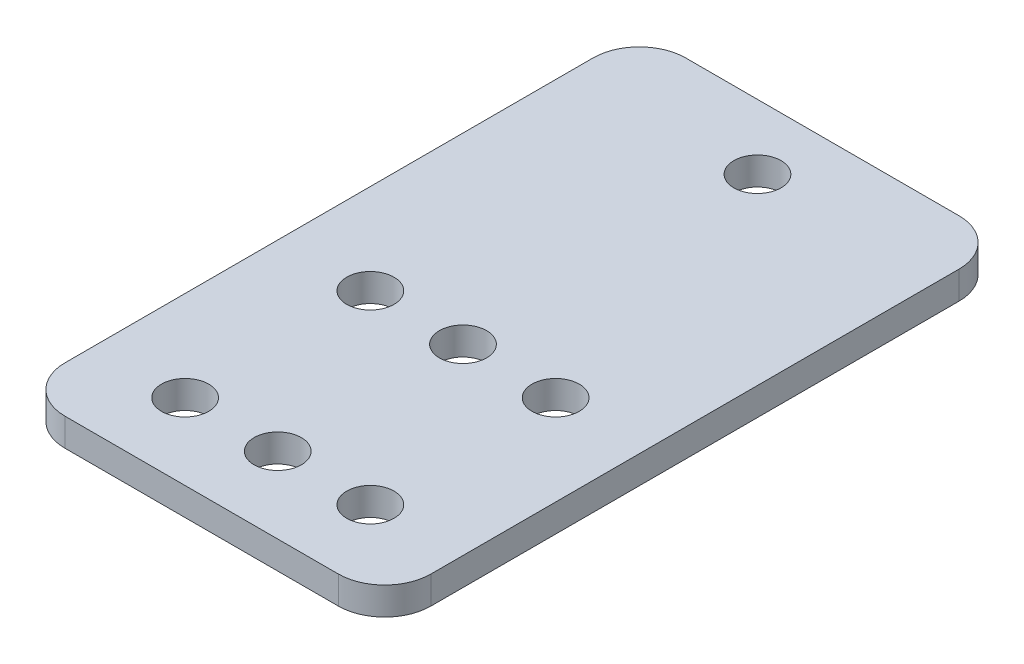
from build123d import *

# Parameters (mm, degrees)
SKETCH1_W           = 39.5
SKETCH1_H           = 67
BOSS_EXTRUDE1_DEPTH = 3
SKETCH2_R           = 2.55
CUT_EXTRUDE1_DEPTH  = 40.004006204
FILLET1_R           = 5


with BuildPart() as part:
    # Sketch1 → Boss-Extrude1 (new body)
    with BuildSketch(Plane(origin=(0, 0, 0), x_dir=(1, 0, 0), z_dir=(0, 1, 0))):
        Rectangle(SKETCH1_W, SKETCH1_H)
    extrude(amount=BOSS_EXTRUDE1_DEPTH)

    # Sketch2 → Cut-Extrude1 (cut, through all)
    with BuildSketch(Plane(origin=(0, 3, 0), x_dir=(1, 0, 0), z_dir=(0, 1, 0))):
        with Locations(Location((0, -5.29, 0), (0, 0, 270))):
            Circle(SKETCH2_R)
        with Locations(Location((0, -25.29, 0), (0, 0, 270))):
            Circle(SKETCH2_R)
        with Locations(Location((-10, -5.29, 0), (0, 0, 270))):
            Circle(SKETCH2_R)
        with Locations(Location((-10, -25.29, 0), (0, 0, 270))):
            Circle(SKETCH2_R)
        with Locations(Location((0, 26.5, 0), (0, 0, 270))):
            Circle(SKETCH2_R)
        with Locations(Location((10, -25.29, 0), (0, 0, 90))):
            Circle(SKETCH2_R)
        with Locations(Location((10, -5.29, 0), (0, 0, 90))):
            Circle(SKETCH2_R)
    extrude(amount=-CUT_EXTRUDE1_DEPTH, mode=Mode.SUBTRACT)

    # Fillet1
    fillet1_edges = [part.edges().sort_by_distance(p)[0] for p in [
        (19.75, 1.5, 33.5),
        (-19.75, 1.5, 33.5),
        (-19.75, 1.5, -33.5),
        (19.75, 1.5, -33.5),
    ]]
    fillet(fillet1_edges, radius=FILLET1_R)


solid = part.part
